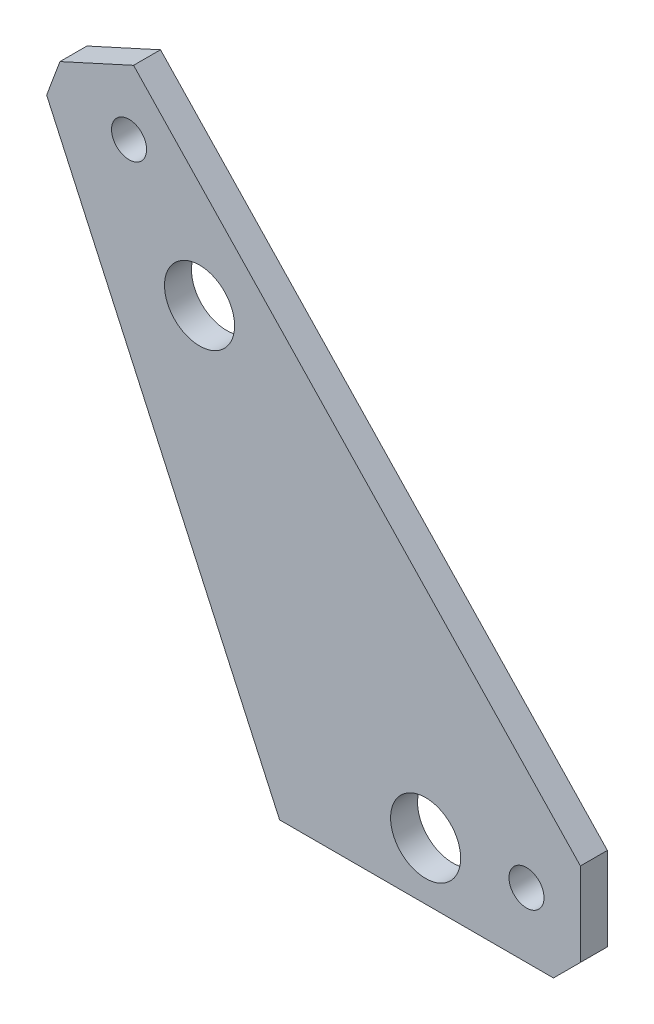
from build123d import *

# Parameters (mm, degrees)
BOSS_EXTRUDE1_DEPTH = 10
SKETCH2_R           = 6.5
SKETCH2_R_2         = 13
CUT_EXTRUDE1_DEPTH  = 10


with BuildPart() as part:
    # Sketch1 → Boss-Extrude1 (new body)
    with BuildSketch(Plane.XY):
        with BuildLine():
            Line((103.422242509, -51.995703566), (103.422242509, -82.995703566))
            Line((103.422242509, -82.995703566), (93.422242509, -92.995703566))
            Line((93.422242509, -92.995703566), (-8.05332169, -92.995703566))
            ThreePointArc((-8.05332169, -92.995703566), (-8.161516585, -92.963911368), (-8.235313944, -92.878642214))
            Line((-8.235313944, -92.878642214), (-94.615281586, 96.66489756))
            Line((-94.615281586, 96.66489756), (-89.662601304, 109.911442695))
            Line((-89.662601304, 109.911442695), (-62.363763178, 122.352239975))
            Line((-62.363763178, 122.352239975), (103.422242509, -51.995703566))
        make_face()
    extrude(amount=BOSS_EXTRUDE1_DEPTH)

    # Sketch2 → Cut-Extrude1 (cut)
    with BuildSketch(Plane.XY.offset(10)):
        with Locations((83.422242509, -68.995703566)):
            Circle(SKETCH2_R)
        with Locations((-64.03112347, 97.68108884)):
            Circle(SKETCH2_R)
        with Locations((-37.88844979, 57.424901579)):
            Circle(SKETCH2_R_2)
        with Locations((45.985961603, -71.730365885)):
            Circle(SKETCH2_R_2)
    extrude(amount=-CUT_EXTRUDE1_DEPTH, mode=Mode.SUBTRACT)


solid = part.part
